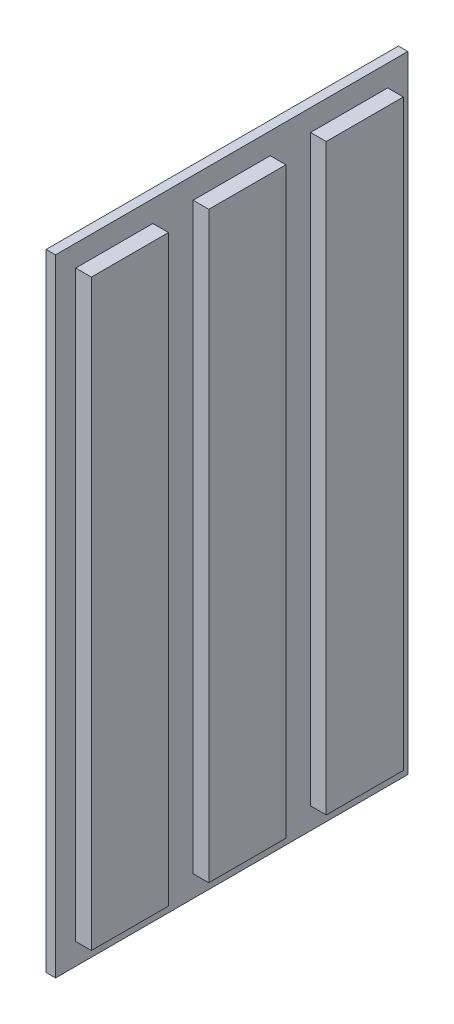
from build123d import *

# Parameters (mm, degrees)
SKETCH1_W           = 80
SKETCH1_H           = 45
BOSS_EXTRUDE1_DEPTH = 1.2
SKETCH2_W           = 74.5
SKETCH2_H           = 9.85
BOSS_EXTRUDE2_DEPTH = 2
LPATTERN1_COUNT     = 3
LPATTERN1_PITCH     = 15
SKETCH3_W           = 2.467948718
SKETCH3_H           = 0.224358974
CUT_EXTRUDE1_DEPTH  = 0.6


with BuildPart() as part:
    # Sketch1 → Boss-Extrude1 (new body)
    with BuildSketch(Plane.YZ):
        Rectangle(SKETCH1_W, SKETCH1_H)
    extrude(amount=-BOSS_EXTRUDE1_DEPTH)

    # Sketch2 → Boss-Extrude2 (add)
    with BuildSketch(Plane.YZ):
        with Locations((0, 15)):
            Rectangle(SKETCH2_W, SKETCH2_H)
    boss_extrude2 = extrude(amount=BOSS_EXTRUDE2_DEPTH)

    # LPattern1: Boss-Extrude2 ×3
    with Locations(*[(0, 0, -i * LPATTERN1_PITCH) for i in range(1, LPATTERN1_COUNT)]):
        add(boss_extrude2)

    # Sketch3 → Cut-Extrude1 (cut)
    # profile 1 of 10: a face of its own
    with BuildSketch(Plane(origin=(-1.2, 0, 0), x_dir=(0, -1, 0), z_dir=(-1, 0, 0))):
        with BuildLine():
            Line((-12.550080128, 4.83525641), (-13.106770833, 5.115705128))
            Line((-13.106770833, 5.115705128), (-12.496794872, 6.316025641))
            add(Edge.make_bspline(
                [(-12.496794872, 6.316025641), (-12.532833652, 6.316944222), (-12.603586497, 6.318747618), (-12.707764541, 6.333733822), (-12.807387496, 6.359316228), (-12.903629589, 6.393372857), (-12.995159823, 6.439029296), (-13.083088073, 6.49351786), (-13.166197117, 6.558985086), (-13.244876618, 6.632572956), (-13.316713516, 6.713911371), (-13.379066424, 6.80138946), (-13.433414156, 6.89278816), (-13.475677933, 6.990170863), (-13.509624414, 7.091722597), (-13.534427424, 7.197969005), (-13.548346218, 7.309376228), (-13.550291671, 7.385198766), (-13.551282051, 7.423798077)],
                knots=[0, 0, 0, 0, 1.014336294, 1.991387562, 2.955278539, 3.906441712, 4.859855302, 5.829322156, 6.813833455, 7.833278715, 8.858926674, 9.863225732, 10.85404919, 11.846815163, 12.845559416, 13.865450493, 14.913355531, 16, 16, 16, 16], degree=3))
            add(Edge.make_bspline(
                [(-13.551282051, 7.423798077), (-13.550363419, 7.461239029), (-13.548553274, 7.535015649), (-13.533519845, 7.643295719), (-13.508778711, 7.747260406), (-13.474834762, 7.846892046), (-13.429646728, 7.941518808), (-13.376755284, 8.032622327), (-13.312097893, 8.118317768), (-13.239057038, 8.198976108), (-13.159117699, 8.272764248), (-13.07430877, 8.337642055), (-12.985015866, 8.391873668), (-12.892386488, 8.437418218), (-12.794746294, 8.471446272), (-12.693506293, 8.497120187), (-12.587912315, 8.511937705), (-12.516237325, 8.513800811), (-12.479967949, 8.51474359)],
                knots=[0, 0, 0, 0, 1.055538678, 2.079917126, 3.075849687, 4.065898488, 5.041806164, 6.028602842, 7.031727914, 8.062953097, 9.093756959, 10.095582084, 11.068815425, 12.035667573, 13.000833448, 13.979119574, 14.977382875, 16, 16, 16, 16], degree=3))
            add(Edge.make_bspline(
                [(-12.479967949, 8.51474359), (-12.442043928, 8.513962965), (-12.367471474, 8.512427971), (-12.258307415, 8.495489925), (-12.153863662, 8.469503864), (-12.053715843, 8.434209492), (-11.95910725, 8.386307724), (-11.869246249, 8.328897121), (-11.784431745, 8.260707436), (-11.705574584, 8.183704107), (-11.633854877, 8.099948579), (-11.570284281, 8.012276747), (-11.516882281, 7.920860034), (-11.473142777, 7.826514303), (-11.439069923, 7.729091749), (-11.415649179, 7.628454183), (-11.400100402, 7.5247737), (-11.398331261, 7.45447067), (-11.397435897, 7.418890224)],
                knots=[0, 0, 0, 0, 1.062826075, 2.08990367, 3.089830715, 4.078784409, 5.060762809, 6.057138927, 7.064407536, 8.107320944, 9.143871033, 10.153461498, 11.140480137, 12.108246174, 13.065926856, 14.029354859, 15.002654194, 16, 16, 16, 16], degree=3))
            add(Edge.make_bspline(
                [(-11.397435897, 7.418890224), (-11.397924506, 7.391753863), (-11.398908673, 7.337095131), (-11.408585754, 7.255128437), (-11.423267836, 7.172934565), (-11.4403095, 7.103829904), (-11.458175314, 7.045578872), (-11.475560786, 6.996163674), (-11.497866858, 6.941303526), (-11.522773816, 6.880630714), (-11.551619006, 6.814411294), (-11.585000479, 6.742961821), (-11.620900749, 6.665222629), (-11.647362792, 6.612065628), (-11.661057692, 6.584555288)],
                knots=[0, 0, 0, 0, 1.105131805, 2.225983929, 3.357782449, 4.505488967, 5.122909461, 5.839607681, 6.638776516, 7.535249922, 8.51168636, 9.581005249, 10.748097757, 12, 12, 12, 12], degree=3))
            Line((-11.661057692, 6.584555288), (-12.550080128, 4.83525641))
        make_face()
        with BuildLine():
            add(Edge.make_bspline(
                [(-12.465945513, 6.899358974), (-12.43584454, 6.901131106), (-12.377034056, 6.904593449), (-12.292556705, 6.931365028), (-12.216953772, 6.977178471), (-12.149944148, 7.038042239), (-12.094569445, 7.11229882), (-12.054308413, 7.196833337), (-12.029508856, 7.289895173), (-12.026955068, 7.354697212), (-12.025641026, 7.388040865)],
                knots=[0, 0, 0, 0, 0.984774978, 1.924027336, 2.867853169, 3.859505234, 4.871392407, 5.881338128, 6.909850265, 8, 8, 8, 8], degree=3))
            add(Edge.make_bspline(
                [(-12.025641026, 7.388040865), (-12.027223646, 7.422078143), (-12.030302222, 7.488288776), (-12.055339348, 7.583584452), (-12.098122761, 7.669726092), (-12.156327147, 7.744606899), (-12.224280008, 7.807272569), (-12.30026846, 7.853048153), (-12.382447344, 7.881354307), (-12.439318006, 7.884798478), (-12.468048878, 7.886538462)],
                knots=[0, 0, 0, 0, 1.104110315, 2.147758178, 3.172670271, 4.206310416, 5.210906102, 6.157051016, 7.068948237, 8, 8, 8, 8], degree=3))
            add(Edge.make_bspline(
                [(-12.468048878, 7.886538462), (-12.498415797, 7.884842202), (-12.558040994, 7.88151161), (-12.643567588, 7.853273431), (-12.722409682, 7.808376891), (-12.791260691, 7.7454986), (-12.850848599, 7.671603948), (-12.892400874, 7.585171542), (-12.918688284, 7.490540876), (-12.92158774, 7.424211507), (-12.923076923, 7.390144231)],
                knots=[0, 0, 0, 0, 0.970967322, 1.90648639, 2.855811969, 3.858352357, 4.877096915, 5.878517833, 6.91039038, 8, 8, 8, 8], degree=3))
            add(Edge.make_bspline(
                [(-12.923076923, 7.390144231), (-12.921521379, 7.356562559), (-12.918496009, 7.291249713), (-12.89314033, 7.197660087), (-12.85183847, 7.112678206), (-12.79537588, 7.037836006), (-12.725827875, 6.976672356), (-12.646861468, 6.931346919), (-12.558776269, 6.904520858), (-12.497446118, 6.901110576), (-12.465945513, 6.899358974)],
                knots=[0, 0, 0, 0, 1.075706617, 2.092137047, 3.084482865, 4.090466434, 5.0784141, 6.035155512, 6.990809768, 8, 8, 8, 8], degree=3))
        make_face(mode=Mode.SUBTRACT)
    # profile 2 of 10: a face of its own
    with BuildSketch(Plane(origin=(-1.2, 0, 0), x_dir=(0, -1, 0), z_dir=(-1, 0, 0))):
        with BuildLine():
            Line((-10.320512821, 7.258333333), (-10.948717949, 7.258333333))
            add(Edge.make_bspline(
                [(-10.948717949, 7.258333333), (-10.946004827, 7.305853728), (-10.94070355, 7.398705726), (-10.919616412, 7.533576225), (-10.891360369, 7.661014017), (-10.853648929, 7.780573308), (-10.806262038, 7.892210656), (-10.750419082, 7.996306638), (-10.684693399, 8.092313186), (-10.61048385, 8.179767303), (-10.529050308, 8.258223199), (-10.442083414, 8.327787125), (-10.34825289, 8.385189525), (-10.249273099, 8.432426387), (-10.145160894, 8.470166444), (-10.03493121, 8.495398727), (-9.919538475, 8.512486275), (-9.840542804, 8.513981504), (-9.800280449, 8.51474359)],
                knots=[0, 0, 0, 0, 1.199038563, 2.342849363, 3.436047546, 4.486744587, 5.497670872, 6.488682221, 7.459191391, 8.424610317, 9.374430501, 10.305433194, 11.225809216, 12.140057399, 13.06607119, 14.010487599, 14.985989317, 16, 16, 16, 16], degree=3))
            add(Edge.make_bspline(
                [(-9.800280449, 8.51474359), (-9.750858979, 8.51320151), (-9.654376689, 8.510191008), (-9.514180268, 8.484510428), (-9.38325214, 8.441555691), (-9.261687476, 8.381536594), (-9.150521179, 8.305288623), (-9.049771682, 8.214375396), (-8.962485811, 8.106889507), (-8.888110148, 7.987303267), (-8.826312862, 7.86067827), (-8.783007897, 7.729742772), (-8.75454401, 7.59797127), (-8.75150816, 7.509243011), (-8.75, 7.465164263)],
                knots=[0, 0, 0, 0, 1.075374347, 2.099382735, 3.09057751, 4.06680945, 5.040638231, 6.016817125, 7.011024321, 8.044445721, 9.0776792, 10.070479129, 11.0414456, 12, 12, 12, 12], degree=3))
            add(Edge.make_bspline(
                [(-8.75, 7.465164263), (-8.750587198, 7.438502321), (-8.751769083, 7.384838418), (-8.759986883, 7.303631761), (-8.772315208, 7.220913287), (-8.790903318, 7.136753919), (-8.814084215, 7.051130065), (-8.842205993, 6.963785484), (-8.875920965, 6.875215386), (-8.914666496, 6.784422931), (-8.960890013, 6.691113351), (-9.014710874, 6.593887899), (-9.077557606, 6.492832821), (-9.148671099, 6.387377529), (-9.228396736, 6.27768834), (-9.31712371, 6.164095673), (-9.413830094, 6.046199265), (-9.482465336, 5.967392132), (-9.517728365, 5.926903045)],
                knots=[0, 0, 0, 0, 0.728284026, 1.46585585, 2.227944881, 3.01186502, 3.81876927, 4.650621989, 5.517437689, 6.406905708, 7.346299482, 8.360816762, 9.441613733, 10.596154504, 11.834900912, 13.145207542, 14.533280747, 16, 16, 16, 16], degree=3))
            Line((-9.517728365, 5.926903045), (-9.883012821, 5.508333333))
            Line((-9.883012821, 5.508333333), (-8.705128205, 5.508333333))
            Line((-8.705128205, 5.508333333), (-8.705128205, 4.925))
            Line((-8.705128205, 4.925), (-11.038461538, 4.925))
            Line((-11.038461538, 4.925), (-11.038461538, 5.243309295))
            Line((-11.038461538, 5.243309295), (-10.002203526, 6.346173878))
            add(Edge.make_bspline(
                [(-10.002203526, 6.346173878), (-9.972201193, 6.378344781), (-9.914095573, 6.440650278), (-9.831417263, 6.53215253), (-9.756600696, 6.618985982), (-9.691197254, 6.702075237), (-9.631774648, 6.778725216), (-9.580982529, 6.851246247), (-9.538356188, 6.918982712), (-9.492079249, 7.000661059), (-9.448131369, 7.098077022), (-9.40780653, 7.210304206), (-9.383225749, 7.317567547), (-9.379832824, 7.387462646), (-9.378205128, 7.42099359)],
                knots=[0, 0, 0, 0, 1.246127091, 2.413378631, 3.493388633, 4.492180848, 5.408488754, 6.240484944, 6.999099869, 7.674939598, 8.898438119, 10.020720584, 11.050475521, 12, 12, 12, 12], degree=3))
            add(Edge.make_bspline(
                [(-9.378205128, 7.42099359), (-9.379422117, 7.453432191), (-9.381780229, 7.516287182), (-9.407693962, 7.605698073), (-9.447840416, 7.686650506), (-9.50441244, 7.756725534), (-9.57293888, 7.814310831), (-9.652127617, 7.857141156), (-9.741333032, 7.881854058), (-9.803867728, 7.884947231), (-9.83603766, 7.886538462)],
                knots=[0, 0, 0, 0, 1.062038974, 2.057870785, 3.028805853, 4.01125022, 4.991535629, 5.949134679, 6.94496649, 8, 8, 8, 8], degree=3))
            add(Edge.make_bspline(
                [(-9.83603766, 7.886538462), (-9.852657057, 7.885950642), (-9.885375009, 7.884793424), (-9.933467841, 7.877090139), (-9.979231626, 7.863513903), (-10.02317574, 7.845323658), (-10.0648312, 7.821212358), (-10.104092938, 7.791491338), (-10.141374626, 7.756915879), (-10.176505275, 7.717594092), (-10.208478751, 7.673710967), (-10.236877476, 7.625667285), (-10.260358494, 7.57349287), (-10.281032036, 7.517876502), (-10.296976461, 7.458220817), (-10.30858598, 7.394882848), (-10.317411922, 7.327965636), (-10.319460384, 7.281966346), (-10.320512821, 7.258333333)],
                knots=[0, 0, 0, 0, 0.903469896, 1.778625579, 2.63899355, 3.493148037, 4.358286772, 5.247621495, 6.164656832, 7.118446693, 8.109501108, 9.111810964, 10.146451449, 11.215617525, 12.33435995, 13.498009769, 14.714554818, 16, 16, 16, 16], degree=3))
        make_face()
    # profile 3 of 10: a face of its own
    with BuildSketch(Plane(origin=(-1.2, 0, 0), x_dir=(0, -1, 0), z_dir=(-1, 0, 0))):
        with BuildLine():
            Line((-7.628205128, 7.258333333), (-8.256410256, 7.258333333))
            add(Edge.make_bspline(
                [(-8.256410256, 7.258333333), (-8.253697135, 7.305853728), (-8.248395858, 7.398705726), (-8.227308719, 7.533576225), (-8.199052677, 7.661014017), (-8.161341237, 7.780573308), (-8.113954346, 7.892210656), (-8.058111389, 7.996306638), (-7.992385707, 8.092313186), (-7.918176158, 8.179767303), (-7.836742616, 8.258223199), (-7.749775721, 8.327787125), (-7.655945198, 8.385189525), (-7.556965407, 8.432426387), (-7.452853201, 8.470166444), (-7.342623517, 8.495398727), (-7.227230783, 8.512486275), (-7.148235111, 8.513981504), (-7.107972756, 8.51474359)],
                knots=[0, 0, 0, 0, 1.199038563, 2.342849363, 3.436047546, 4.486744587, 5.497670872, 6.488682221, 7.459191391, 8.424610317, 9.374430501, 10.305433194, 11.225809216, 12.140057399, 13.06607119, 14.010487599, 14.985989317, 16, 16, 16, 16], degree=3))
            add(Edge.make_bspline(
                [(-7.107972756, 8.51474359), (-7.058551287, 8.51320151), (-6.962068997, 8.510191008), (-6.821872576, 8.484510428), (-6.690944447, 8.441555691), (-6.569379784, 8.381536594), (-6.458213487, 8.305288623), (-6.35746399, 8.214375396), (-6.270178119, 8.106889507), (-6.195802456, 7.987303267), (-6.134005169, 7.86067827), (-6.090700205, 7.729742772), (-6.062236318, 7.59797127), (-6.059200468, 7.509243011), (-6.057692308, 7.465164263)],
                knots=[0, 0, 0, 0, 1.075374347, 2.099382735, 3.09057751, 4.06680945, 5.040638231, 6.016817125, 7.011024321, 8.044445721, 9.0776792, 10.070479129, 11.0414456, 12, 12, 12, 12], degree=3))
            add(Edge.make_bspline(
                [(-6.057692308, 7.465164263), (-6.058279506, 7.438502321), (-6.05946139, 7.384838418), (-6.067679191, 7.303631761), (-6.080007516, 7.220913287), (-6.098595626, 7.136753919), (-6.121776522, 7.051130065), (-6.1498983, 6.963785484), (-6.183613272, 6.875215386), (-6.222358804, 6.784422931), (-6.268582321, 6.691113351), (-6.322403182, 6.593887899), (-6.385249913, 6.492832821), (-6.456363407, 6.387377529), (-6.536089043, 6.27768834), (-6.624816017, 6.164095673), (-6.721522402, 6.046199265), (-6.790157644, 5.967392132), (-6.825420673, 5.926903045)],
                knots=[0, 0, 0, 0, 0.728284026, 1.46585585, 2.227944881, 3.01186502, 3.81876927, 4.650621989, 5.517437689, 6.406905708, 7.346299482, 8.360816762, 9.441613733, 10.596154504, 11.834900912, 13.145207542, 14.533280747, 16, 16, 16, 16], degree=3))
            Line((-6.825420673, 5.926903045), (-7.190705128, 5.508333333))
            Line((-7.190705128, 5.508333333), (-6.012820513, 5.508333333))
            Line((-6.012820513, 5.508333333), (-6.012820513, 4.925))
            Line((-6.012820513, 4.925), (-8.346153846, 4.925))
            Line((-8.346153846, 4.925), (-8.346153846, 5.243309295))
            Line((-8.346153846, 5.243309295), (-7.309895833, 6.346173878))
            add(Edge.make_bspline(
                [(-7.309895833, 6.346173878), (-7.279893501, 6.378344781), (-7.22178788, 6.440650278), (-7.13910957, 6.53215253), (-7.064293003, 6.618985982), (-6.998889561, 6.702075237), (-6.939466956, 6.778725216), (-6.888674837, 6.851246247), (-6.846048496, 6.918982712), (-6.799771557, 7.000661059), (-6.755823677, 7.098077022), (-6.715498837, 7.210304206), (-6.690918057, 7.317567547), (-6.687525132, 7.387462646), (-6.685897436, 7.42099359)],
                knots=[0, 0, 0, 0, 1.246127091, 2.413378631, 3.493388633, 4.492180848, 5.408488754, 6.240484944, 6.999099869, 7.674939598, 8.898438119, 10.020720584, 11.050475521, 12, 12, 12, 12], degree=3))
            add(Edge.make_bspline(
                [(-6.685897436, 7.42099359), (-6.687114425, 7.453432191), (-6.689472536, 7.516287182), (-6.71538627, 7.605698073), (-6.755532724, 7.686650506), (-6.812104748, 7.756725534), (-6.880631188, 7.814310831), (-6.959819925, 7.857141156), (-7.04902534, 7.881854058), (-7.111560035, 7.884947231), (-7.143729968, 7.886538462)],
                knots=[0, 0, 0, 0, 1.062038974, 2.057870785, 3.028805853, 4.01125022, 4.991535629, 5.949134679, 6.94496649, 8, 8, 8, 8], degree=3))
            add(Edge.make_bspline(
                [(-7.143729968, 7.886538462), (-7.160349365, 7.885950642), (-7.193067317, 7.884793424), (-7.241160149, 7.877090139), (-7.286923934, 7.863513903), (-7.330868048, 7.845323658), (-7.372523508, 7.821212358), (-7.411785246, 7.791491338), (-7.449066934, 7.756915879), (-7.484197582, 7.717594092), (-7.516171059, 7.673710967), (-7.544569784, 7.625667285), (-7.568050802, 7.57349287), (-7.588724344, 7.517876502), (-7.604668768, 7.458220817), (-7.616278287, 7.394882848), (-7.625104229, 7.327965636), (-7.627152692, 7.281966346), (-7.628205128, 7.258333333)],
                knots=[0, 0, 0, 0, 0.903469896, 1.778625579, 2.63899355, 3.493148037, 4.358286772, 5.247621495, 6.164656832, 7.118446693, 8.109501108, 9.111810964, 10.146451449, 11.215617525, 12.33435995, 13.498009769, 14.714554818, 16, 16, 16, 16], degree=3))
        make_face()
    # profile 4 of 10: a face of its own
    with BuildSketch(Plane(origin=(-1.2, 0, 0), x_dir=(0, -1, 0), z_dir=(-1, 0, 0))):
        with BuildLine():
            Line((-4.935897436, 7.258333333), (-5.564102564, 7.258333333))
            add(Edge.make_bspline(
                [(-5.564102564, 7.258333333), (-5.561389442, 7.305853728), (-5.556088166, 7.398705726), (-5.535001027, 7.533576225), (-5.506744984, 7.661014017), (-5.469033545, 7.780573308), (-5.421646653, 7.892210656), (-5.365803697, 7.996306638), (-5.300078015, 8.092313186), (-5.225868466, 8.179767303), (-5.144434924, 8.258223199), (-5.057468029, 8.327787125), (-4.963637506, 8.385189525), (-4.864657714, 8.432426387), (-4.760545509, 8.470166444), (-4.650315825, 8.495398727), (-4.53492309, 8.512486275), (-4.455927419, 8.513981504), (-4.415665064, 8.51474359)],
                knots=[0, 0, 0, 0, 1.199038563, 2.342849363, 3.436047546, 4.486744587, 5.497670872, 6.488682221, 7.459191391, 8.424610317, 9.374430501, 10.305433194, 11.225809216, 12.140057399, 13.06607119, 14.010487599, 14.985989317, 16, 16, 16, 16], degree=3))
            add(Edge.make_bspline(
                [(-4.415665064, 8.51474359), (-4.366243595, 8.51320151), (-4.269761304, 8.510191008), (-4.129564884, 8.484510428), (-3.998636755, 8.441555691), (-3.877072092, 8.381536594), (-3.765905794, 8.305288623), (-3.665156297, 8.214375396), (-3.577870427, 8.106889507), (-3.503494764, 7.987303267), (-3.441697477, 7.86067827), (-3.398392513, 7.729742772), (-3.369928626, 7.59797127), (-3.366892776, 7.509243011), (-3.365384615, 7.465164263)],
                knots=[0, 0, 0, 0, 1.075374347, 2.099382735, 3.09057751, 4.06680945, 5.040638231, 6.016817125, 7.011024321, 8.044445721, 9.0776792, 10.070479129, 11.0414456, 12, 12, 12, 12], degree=3))
            add(Edge.make_bspline(
                [(-3.365384615, 7.465164263), (-3.365971813, 7.438502321), (-3.367153698, 7.384838418), (-3.375371499, 7.303631761), (-3.387699824, 7.220913287), (-3.406287933, 7.136753919), (-3.42946883, 7.051130065), (-3.457590608, 6.963785484), (-3.49130558, 6.875215386), (-3.530051112, 6.784422931), (-3.576274629, 6.691113351), (-3.630095489, 6.593887899), (-3.692942221, 6.492832821), (-3.764055715, 6.387377529), (-3.843781351, 6.27768834), (-3.932508325, 6.164095673), (-4.02921471, 6.046199265), (-4.097849951, 5.967392132), (-4.133112981, 5.926903045)],
                knots=[0, 0, 0, 0, 0.728284026, 1.46585585, 2.227944881, 3.01186502, 3.81876927, 4.650621989, 5.517437689, 6.406905708, 7.346299482, 8.360816762, 9.441613733, 10.596154504, 11.834900912, 13.145207542, 14.533280747, 16, 16, 16, 16], degree=3))
            Line((-4.133112981, 5.926903045), (-4.498397436, 5.508333333))
            Line((-4.498397436, 5.508333333), (-3.320512821, 5.508333333))
            Line((-3.320512821, 5.508333333), (-3.320512821, 4.925))
            Line((-3.320512821, 4.925), (-5.653846154, 4.925))
            Line((-5.653846154, 4.925), (-5.653846154, 5.243309295))
            Line((-5.653846154, 5.243309295), (-4.617588141, 6.346173878))
            add(Edge.make_bspline(
                [(-4.617588141, 6.346173878), (-4.587585809, 6.378344781), (-4.529480188, 6.440650278), (-4.446801878, 6.53215253), (-4.371985311, 6.618985982), (-4.306581869, 6.702075237), (-4.247159264, 6.778725216), (-4.196367145, 6.851246247), (-4.153740804, 6.918982712), (-4.107463864, 7.000661059), (-4.063515985, 7.098077022), (-4.023191145, 7.210304206), (-3.998610365, 7.317567547), (-3.99521744, 7.387462646), (-3.993589744, 7.42099359)],
                knots=[0, 0, 0, 0, 1.246127091, 2.413378631, 3.493388633, 4.492180848, 5.408488754, 6.240484944, 6.999099869, 7.674939598, 8.898438119, 10.020720584, 11.050475521, 12, 12, 12, 12], degree=3))
            add(Edge.make_bspline(
                [(-3.993589744, 7.42099359), (-3.994806733, 7.453432191), (-3.997164844, 7.516287182), (-4.023078577, 7.605698073), (-4.063225032, 7.686650506), (-4.119797056, 7.756725534), (-4.188323495, 7.814310831), (-4.267512233, 7.857141156), (-4.356717648, 7.881854058), (-4.419252343, 7.884947231), (-4.451422276, 7.886538462)],
                knots=[0, 0, 0, 0, 1.062038974, 2.057870785, 3.028805853, 4.01125022, 4.991535629, 5.949134679, 6.94496649, 8, 8, 8, 8], degree=3))
            add(Edge.make_bspline(
                [(-4.451422276, 7.886538462), (-4.468041673, 7.885950642), (-4.500759624, 7.884793424), (-4.548852456, 7.877090139), (-4.594616241, 7.863513903), (-4.638560355, 7.845323658), (-4.680215815, 7.821212358), (-4.719477553, 7.791491338), (-4.756759241, 7.756915879), (-4.79188989, 7.717594092), (-4.823863367, 7.673710967), (-4.852262092, 7.625667285), (-4.87574311, 7.57349287), (-4.896416651, 7.517876502), (-4.912361076, 7.458220817), (-4.923970595, 7.394882848), (-4.932796537, 7.327965636), (-4.934844999, 7.281966346), (-4.935897436, 7.258333333)],
                knots=[0, 0, 0, 0, 0.903469896, 1.778625579, 2.63899355, 3.493148037, 4.358286772, 5.247621495, 6.164656832, 7.118446693, 8.109501108, 9.111810964, 10.146451449, 11.215617525, 12.33435995, 13.498009769, 14.714554818, 16, 16, 16, 16], degree=3))
        make_face()
    # profile 5 of 10: a face of its own
    with BuildSketch(Plane(origin=(-1.2, 0, 0), x_dir=(0, -1, 0), z_dir=(-1, 0, 0))):
        with BuildLine():
            Line((-2.108974359, 7.572435897), (-2.737179487, 7.572435897))
            add(Edge.make_bspline(
                [(-2.737179487, 7.572435897), (-2.73274412, 7.603837631), (-2.724048877, 7.665398649), (-2.703242322, 7.754523667), (-2.678355437, 7.839064846), (-2.647285433, 7.918754462), (-2.610845373, 7.993734468), (-2.569405812, 8.064262159), (-2.522518772, 8.130034816), (-2.48657936, 8.169656526), (-2.46864984, 8.189423077)],
                knots=[0, 0, 0, 0, 1.111473889, 2.178970933, 3.205615836, 4.199322666, 5.174200091, 6.12565194, 7.064921805, 8, 8, 8, 8], degree=3))
            add(Edge.make_bspline(
                [(-2.46864984, 8.189423077), (-2.442788883, 8.215503609), (-2.391819655, 8.266905597), (-2.306644097, 8.332745865), (-2.217364382, 8.38972614), (-2.122189966, 8.434900514), (-2.022601836, 8.471463936), (-1.917808031, 8.496023669), (-1.808236778, 8.512319269), (-1.733468182, 8.513924443), (-1.6953125, 8.51474359)],
                knots=[0, 0, 0, 0, 1.01925491, 2.00884431, 2.983262333, 3.955970413, 4.92937149, 5.924503185, 6.940838805, 8, 8, 8, 8], degree=3))
            add(Edge.make_bspline(
                [(-1.6953125, 8.51474359), (-1.661390136, 8.513942749), (-1.594705603, 8.512368458), (-1.49669612, 8.499730903), (-1.403252279, 8.477566039), (-1.313386353, 8.448585976), (-1.228419976, 8.409153758), (-1.146477858, 8.363381345), (-1.069849465, 8.307239579), (-0.998355501, 8.243805033), (-0.932674659, 8.175194362), (-0.875794762, 8.101855197), (-0.826894094, 8.025746596), (-0.786606412, 7.946236241), (-0.755630659, 7.86318959), (-0.734132568, 7.777086394), (-0.720061545, 7.688116644), (-0.718659704, 7.627645104), (-0.717948718, 7.59697516)],
                knots=[0, 0, 0, 0, 1.091422571, 2.145516843, 3.172569842, 4.178562979, 5.178154469, 6.181868002, 7.194278174, 8.227918432, 9.254613415, 10.245994977, 11.209837596, 12.161663635, 13.10878368, 14.055455738, 15.013766427, 16, 16, 16, 16], degree=3))
            add(Edge.make_bspline(
                [(-0.717948718, 7.59697516), (-0.719407703, 7.558992989), (-0.722279996, 7.484217771), (-0.745849242, 7.374778683), (-0.78274152, 7.270135386), (-0.836036004, 7.171751995), (-0.902667683, 7.079896255), (-0.984422521, 6.997639179), (-1.078971929, 6.923691089), (-1.149951429, 6.883951376), (-1.186298077, 6.863601763)],
                knots=[0, 0, 0, 0, 0.992805628, 1.954529043, 2.915727527, 3.886831945, 4.871318353, 5.87440735, 6.911542536, 8, 8, 8, 8], degree=3))
            add(Edge.make_bspline(
                [(-1.186298077, 6.863601763), (-1.161350296, 6.855410881), (-1.112329025, 6.839316166), (-1.042651182, 6.807617805), (-0.976395515, 6.772976752), (-0.914702924, 6.73273298), (-0.8569598, 6.688513768), (-0.803518153, 6.639941116), (-0.75405868, 6.587120934), (-0.709388789, 6.52976273), (-0.669742515, 6.468783839), (-0.634170024, 6.405592836), (-0.604891881, 6.339231418), (-0.58008965, 6.270457477), (-0.561206642, 6.19865291), (-0.547911318, 6.124095953), (-0.540226294, 6.046956675), (-0.539054197, 5.994694861), (-0.538461538, 5.968269231)],
                knots=[0, 0, 0, 0, 1.059543567, 2.081955587, 3.086750234, 4.076226789, 5.052108497, 6.020845489, 6.989030705, 7.970690546, 8.952259656, 9.923888338, 10.895517021, 11.877585046, 12.873342345, 13.889638361, 14.932918083, 16, 16, 16, 16], degree=3))
            add(Edge.make_bspline(
                [(-0.538461538, 5.968269231), (-0.539662937, 5.929434283), (-0.54203185, 5.852859676), (-0.55709229, 5.740073116), (-0.585132115, 5.632541152), (-0.622020058, 5.529026466), (-0.671224571, 5.430865394), (-0.72913001, 5.335805276), (-0.800307429, 5.247142768), (-0.87940891, 5.162533864), (-0.967255715, 5.085611238), (-1.062495943, 5.018922782), (-1.163035343, 4.961692221), (-1.269509999, 4.915230822), (-1.38188292, 4.87945023), (-1.499903636, 4.853586369), (-1.624068037, 4.837762431), (-1.708819956, 4.836103592), (-1.752103365, 4.83525641)],
                knots=[0, 0, 0, 0, 1.005138573, 1.981928558, 2.936866704, 3.876260664, 4.820238198, 5.773547, 6.751179199, 7.756627054, 8.768222608, 9.766606018, 10.760583154, 11.757261445, 12.767156078, 13.807575856, 14.880313354, 16, 16, 16, 16], degree=3))
            add(Edge.make_bspline(
                [(-1.752103365, 4.83525641), (-1.793048773, 4.83614962), (-1.873112098, 4.837896173), (-1.990221468, 4.853013474), (-2.101522839, 4.877398908), (-2.207300253, 4.911772198), (-2.307144468, 4.956348482), (-2.401960908, 5.009428835), (-2.489857533, 5.074074806), (-2.571813684, 5.147368157), (-2.646011326, 5.229599134), (-2.712326545, 5.318862899), (-2.769297079, 5.415498884), (-2.817156564, 5.519094222), (-2.855530848, 5.629830648), (-2.88580037, 5.747482976), (-2.906944127, 5.87228106), (-2.913383502, 5.958144797), (-2.916666667, 6.001923077)],
                knots=[0, 0, 0, 0, 1.066544725, 2.085487077, 3.070979577, 4.031932826, 4.977951092, 5.916076795, 6.857635327, 7.814973522, 8.776389752, 9.738577119, 10.707772778, 11.69409279, 12.707140348, 13.757286496, 14.856535458, 16, 16, 16, 16], degree=3))
            Line((-2.916666667, 6.001923077), (-2.288461538, 6.001923077))
            add(Edge.make_bspline(
                [(-2.288461538, 6.001923077), (-2.284480668, 5.979910783), (-2.276726879, 5.937036069), (-2.261603589, 5.874963013), (-2.241895832, 5.817665749), (-2.219108762, 5.76463502), (-2.194495296, 5.715174551), (-2.164756342, 5.671111038), (-2.132071016, 5.631247979), (-2.084905853, 5.583858334), (-2.017480003, 5.535167452), (-1.926432768, 5.492852759), (-1.82515134, 5.468051151), (-1.754345522, 5.46502543), (-1.717748397, 5.463461538)],
                knots=[0, 0, 0, 0, 0.928156231, 1.807827665, 2.648129825, 3.438902246, 4.202261636, 4.936546065, 5.639352463, 6.338805438, 7.70633318, 9.064371875, 10.482673459, 12, 12, 12, 12], degree=3))
            add(Edge.make_bspline(
                [(-1.717748397, 5.463461538), (-1.69832867, 5.463794555), (-1.660289767, 5.464446859), (-1.604416284, 5.471676775), (-1.551188924, 5.483584452), (-1.500508549, 5.499766545), (-1.452052524, 5.52005181), (-1.40674665, 5.546208445), (-1.363667481, 5.576619267), (-1.323283325, 5.610809104), (-1.285967533, 5.648063787), (-1.2549186, 5.68931702), (-1.226542121, 5.731237678), (-1.205554673, 5.776568358), (-1.187165147, 5.822869785), (-1.175909818, 5.871822556), (-1.167411236, 5.922399774), (-1.166917333, 5.957012602), (-1.166666667, 5.974579327)],
                knots=[0, 0, 0, 0, 1.110435564, 2.175094844, 3.216326037, 4.226890168, 5.215276772, 6.21526065, 7.213097102, 8.228249917, 9.239874822, 10.221364777, 11.178138315, 12.128914389, 13.072518965, 14.022636769, 14.996447288, 16, 16, 16, 16], degree=3))
            add(Edge.make_bspline(
                [(-1.166666667, 5.974579327), (-1.167332139, 5.993791534), (-1.168656941, 6.032038636), (-1.179480712, 6.08785224), (-1.196573735, 6.141540428), (-1.220318032, 6.192865444), (-1.252025894, 6.241638115), (-1.289440817, 6.288836968), (-1.33551048, 6.332005386), (-1.386055069, 6.374676059), (-1.444666936, 6.411872017), (-1.508491601, 6.446198421), (-1.579206474, 6.473511641), (-1.655085344, 6.497907405), (-1.737563528, 6.515725692), (-1.82612887, 6.528663506), (-1.920638498, 6.538293703), (-1.985785214, 6.539675313), (-2.019230769, 6.540384615)],
                knots=[0, 0, 0, 0, 0.809814727, 1.612155564, 2.388397, 3.182215007, 3.988903953, 4.837162975, 5.715530372, 6.646997145, 7.623086902, 8.637258368, 9.698941581, 10.815059213, 11.996518529, 13.252603015, 14.589518788, 16, 16, 16, 16], degree=3))
            Line((-2.019230769, 6.540384615), (-2.019230769, 7.123717949))
            add(Edge.make_bspline(
                [(-2.019230769, 7.123717949), (-1.977589064, 7.12726429), (-1.899685679, 7.133898791), (-1.791551604, 7.149413803), (-1.700516652, 7.170152172), (-1.624392797, 7.195171891), (-1.561184425, 7.227303729), (-1.50596594, 7.262775858), (-1.458409168, 7.303971553), (-1.418217317, 7.349662363), (-1.386065087, 7.398730008), (-1.363309611, 7.450411832), (-1.348283084, 7.503108735), (-1.346859322, 7.539151828), (-1.346153846, 7.557011218)],
                knots=[0, 0, 0, 0, 1.70044513, 3.18119609, 4.440695891, 5.496282586, 6.431922213, 7.318171381, 8.16090191, 8.983045123, 9.787564368, 10.536848927, 11.275007137, 12, 12, 12, 12], degree=3))
            add(Edge.make_bspline(
                [(-1.346153846, 7.557011218), (-1.347370994, 7.57979786), (-1.349746608, 7.624272562), (-1.368196915, 7.687925229), (-1.400224558, 7.744666306), (-1.443168003, 7.794376394), (-1.495496084, 7.835897985), (-1.556833768, 7.866041952), (-1.625850025, 7.883752878), (-1.674406679, 7.885588905), (-1.699519231, 7.886538462)],
                knots=[0, 0, 0, 0, 1.009664648, 1.970651636, 2.907870547, 3.878035693, 4.867062054, 5.849714035, 6.887914197, 8, 8, 8, 8], degree=3))
            add(Edge.make_bspline(
                [(-1.699519231, 7.886538462), (-1.722280935, 7.885418084), (-1.767447128, 7.883194913), (-1.83349362, 7.866601749), (-1.896215784, 7.838669222), (-1.95431482, 7.800151914), (-2.006952056, 7.75389426), (-2.05015204, 7.69911167), (-2.086083739, 7.639086265), (-2.10131424, 7.594739782), (-2.108974359, 7.572435897)],
                knots=[0, 0, 0, 0, 0.98818071, 1.960853194, 2.938124878, 3.957524365, 4.978590984, 5.968022688, 6.978025184, 8, 8, 8, 8], degree=3))
        make_face()
    # profile 6 of 10: a face of its own
    with BuildSketch(Plane(origin=(-1.2, 0, 0), x_dir=(0, -1, 0), z_dir=(-1, 0, 0))):
        with BuildLine():
            add(Edge.make_bspline(
                [(0.954226763, 8.51474359), (0.984634498, 8.514292178), (1.044424231, 8.513404583), (1.132483252, 8.503791201), (1.217308437, 8.489268063), (1.299231631, 8.469013349), (1.377663143, 8.442206957), (1.453173814, 8.410120165), (1.524864849, 8.371069956), (1.593650537, 8.326960738), (1.659504381, 8.277022851), (1.720843632, 8.22009108), (1.778788473, 8.15747543), (1.832084613, 8.088229263), (1.881912311, 8.012982447), (1.92810784, 7.93172305), (1.970317564, 7.844053361), (2.009014552, 7.749815174), (2.043617521, 7.647595899), (2.072763559, 7.536223037), (2.097761163, 7.415671153), (2.118860905, 7.285640176), (2.1348089, 7.145957264), (2.145558169, 6.996715214), (2.152934827, 6.838201744), (2.153536858, 6.729462806), (2.153846154, 6.673597756)],
                knots=[0, 0, 0, 0, 0.879237366, 1.728815576, 2.559023295, 3.367336655, 4.166867292, 4.954216142, 5.737608147, 6.525189134, 7.316157332, 8.124696809, 8.942788509, 9.781158001, 10.649253743, 11.551476218, 12.482711956, 13.461909668, 14.496590415, 15.601789533, 16.789733467, 18.056700938, 19.410929216, 20.8549011, 22.384193279, 24, 24, 24, 24], degree=3))
            add(Edge.make_bspline(
                [(2.153846154, 6.673597756), (2.153511889, 6.617033772), (2.152862417, 6.507130965), (2.145864819, 6.34716765), (2.133814624, 6.196842014), (2.118283464, 6.056169608), (2.097010023, 5.925224719), (2.072095866, 5.803668289), (2.042489766, 5.691544378), (2.006746987, 5.589105625), (1.968284233, 5.494701935), (1.925959047, 5.407203181), (1.880509153, 5.326372369), (1.832977033, 5.250990055), (1.780756801, 5.183278471), (1.726390164, 5.120935071), (1.667509902, 5.066334593), (1.6065951, 5.016663175), (1.541414204, 4.973737102), (1.472639406, 4.936194666), (1.399044572, 4.905743291), (1.32197121, 4.879258312), (1.240105589, 4.860244955), (1.154748543, 4.84515848), (1.064936407, 4.836820769), (1.003788688, 4.835786421), (0.972455929, 4.83525641)],
                knots=[0, 0, 0, 0, 1.643780988, 3.193836972, 4.651895693, 6.025988579, 7.305620092, 8.505800249, 9.631074763, 10.672816429, 11.65661981, 12.592235626, 13.49536222, 14.350718032, 15.179365177, 15.97804903, 16.751647189, 17.51006938, 18.259804725, 19.016521909, 19.783502495, 20.571750527, 21.382245291, 22.22305063, 23.089471752, 24, 24, 24, 24], degree=3))
            add(Edge.make_bspline(
                [(0.972455929, 4.83525641), (0.941124017, 4.835796645), (0.87974526, 4.836854957), (0.789690263, 4.845096486), (0.703880868, 4.86030607), (0.621367558, 4.879404282), (0.542724615, 4.90568469), (0.467574946, 4.937047148), (0.396496389, 4.974355338), (0.329292139, 5.017381425), (0.266191648, 5.066720504), (0.206214336, 5.121844838), (0.149492877, 5.182614701), (0.096890145, 5.249710765), (0.047544658, 5.322237439), (0.001971013, 5.401022941), (-0.039803403, 5.485952561), (-0.0790853, 5.577144684), (-0.113216296, 5.67656257), (-0.143591298, 5.785094009), (-0.1684737, 5.9036437), (-0.188485793, 6.032173557), (-0.204463437, 6.170411285), (-0.216348968, 6.318423606), (-0.223385434, 6.476279462), (-0.224028095, 6.584781655), (-0.224358974, 6.640645032)],
                knots=[0, 0, 0, 0, 0.917216111, 1.796812873, 2.643793957, 3.46689424, 4.273913431, 5.068098542, 5.848489301, 6.620921603, 7.401012384, 8.190319798, 9.003608147, 9.831726257, 10.68377682, 11.569763213, 12.493818149, 13.453288342, 14.474581811, 15.568529029, 16.750744269, 18.018426408, 19.375425659, 20.823733699, 22.36466933, 24, 24, 24, 24], degree=3))
            add(Edge.make_bspline(
                [(-0.224358974, 6.640645032), (-0.223759617, 6.718262797), (-0.222603148, 6.868027275), (-0.207947528, 7.084393402), (-0.186436794, 7.284386406), (-0.154842622, 7.467671749), (-0.115776865, 7.634928265), (-0.065751129, 7.785054156), (-0.008800468, 7.920126752), (0.039728812, 8.000144571), (0.063100962, 8.038681891)],
                knots=[0, 0, 0, 0, 1.288568992, 2.486310467, 3.599230591, 4.627010532, 5.572937695, 6.447898582, 7.252493626, 8, 8, 8, 8], degree=3))
            add(Edge.make_bspline(
                [(0.063100962, 8.038681891), (0.090276983, 8.076540942), (0.143411461, 8.150562848), (0.236318581, 8.247739774), (0.336135185, 8.330850239), (0.444911449, 8.39801338), (0.560927032, 8.450978238), (0.685177985, 8.488386721), (0.817205472, 8.510182647), (0.907870949, 8.513200572), (0.954226763, 8.51474359)],
                knots=[0, 0, 0, 0, 1.058512271, 2.069600068, 3.047294572, 4.004278952, 4.967380941, 5.939006123, 6.946246673, 8, 8, 8, 8], degree=3))
        make_face()
        with BuildLine():
            add(Edge.make_bspline(
                [(0.969651442, 7.886538462), (0.942162597, 7.885235545), (0.888269869, 7.882681137), (0.810068952, 7.860997815), (0.73633037, 7.827506756), (0.680239401, 7.787205503), (0.638255868, 7.748571918), (0.608921672, 7.713609781), (0.580633464, 7.674594555), (0.555647894, 7.629765685), (0.532054994, 7.580733924), (0.508997619, 7.527276698), (0.490096626, 7.468080981), (0.471526901, 7.404154885), (0.45525809, 7.333731022), (0.441628393, 7.256233756), (0.429451456, 7.171159114), (0.420957898, 7.078451372), (0.413039352, 6.978207526), (0.407362964, 6.870204271), (0.404989809, 6.754470744), (0.404235455, 6.674766781), (0.403846154, 6.633633814)],
                knots=[0, 0, 0, 0, 1.076674018, 2.110852608, 3.161083442, 4.239746716, 4.804137807, 5.395870207, 6.026861976, 6.692161227, 7.405688833, 8.16177676, 8.973626916, 9.841385931, 10.773283133, 11.807421078, 12.927755683, 14.143907515, 15.458935494, 16.872852025, 18.386167141, 20, 20, 20, 20], degree=3))
            add(Edge.make_bspline(
                [(0.403846154, 6.633633814), (0.404486896, 6.580344067), (0.405715566, 6.478157026), (0.412150765, 6.331208503), (0.425049587, 6.197473515), (0.441093118, 6.076045689), (0.463626913, 5.967712518), (0.489553502, 5.87144907), (0.521570534, 5.78848247), (0.558572384, 5.717612834), (0.5995536, 5.657324181), (0.644040513, 5.606078555), (0.690518503, 5.561702261), (0.740438298, 5.525655944), (0.793680806, 5.498031708), (0.849801549, 5.478161936), (0.908836191, 5.465998822), (0.949262505, 5.464312189), (0.969651442, 5.463461538)],
                knots=[0, 0, 0, 0, 1.771748488, 3.397459088, 4.888034009, 6.237357457, 7.467047327, 8.564189669, 9.548206622, 10.417051504, 11.216568818, 11.965764335, 12.669334354, 13.348544111, 14.005342236, 14.656555988, 15.322436492, 16, 16, 16, 16], degree=3))
            add(Edge.make_bspline(
                [(0.969651442, 5.463461538), (0.989340696, 5.464043617), (1.027889806, 5.465183253), (1.084103041, 5.476881469), (1.137262271, 5.495900227), (1.187206991, 5.522803595), (1.234115846, 5.557015344), (1.277759575, 5.598685815), (1.317809025, 5.648230366), (1.341142017, 5.684999749), (1.353165064, 5.703946314)],
                knots=[0, 0, 0, 0, 0.992283464, 1.942767638, 2.88273346, 3.832339453, 4.79467288, 5.803907806, 6.868395428, 8, 8, 8, 8], degree=3))
            add(Edge.make_bspline(
                [(1.353165064, 5.703946314), (1.367320177, 5.729836189), (1.397002302, 5.784125158), (1.431350507, 5.875735767), (1.460262912, 5.979057394), (1.485147396, 6.094411585), (1.502166865, 6.22225331), (1.516824011, 6.361771915), (1.523893517, 6.513669958), (1.525043411, 6.61890547), (1.525641026, 6.673597756)],
                knots=[0, 0, 0, 0, 0.710965849, 1.490837728, 2.352621235, 3.297892224, 4.334225155, 5.461620853, 6.680770821, 8, 8, 8, 8], degree=3))
            add(Edge.make_bspline(
                [(1.525641026, 6.673597756), (1.52541018, 6.728764798), (1.524965841, 6.834951935), (1.516813514, 6.987396063), (1.505460776, 7.126628473), (1.488854998, 7.252338316), (1.467488645, 7.364830761), (1.441154535, 7.464098454), (1.410108578, 7.550337033), (1.373291774, 7.623460505), (1.332514875, 7.685605426), (1.289228952, 7.738920947), (1.243250974, 7.784440394), (1.194657832, 7.822335064), (1.142324821, 7.851289435), (1.087251568, 7.871733616), (1.02932517, 7.884101659), (0.989811166, 7.885715231), (0.969651442, 7.886538462)],
                knots=[0, 0, 0, 0, 1.793836731, 3.452829483, 4.963243077, 6.335886805, 7.574563692, 8.684454726, 9.672768357, 10.54971625, 11.340229787, 12.085688095, 12.778991901, 13.440269426, 14.083255152, 14.715733572, 15.344777694, 16, 16, 16, 16], degree=3))
        make_face(mode=Mode.SUBTRACT)
    # profile 7 of 10: a face of its own
    with BuildSketch(Plane(origin=(-1.2, 0, 0), x_dir=(0, -1, 0), z_dir=(-1, 0, 0))):
        with BuildLine():
            Line((3.710336538, 8.51474359), (4.267027244, 8.232191506))
            Line((4.267027244, 8.232191506), (3.657051282, 7.033974359))
            add(Edge.make_bspline(
                [(3.657051282, 7.033974359), (3.693090008, 7.03305571), (3.763842747, 7.031252179), (3.868021559, 7.016266952), (3.967641672, 6.990680927), (4.063894231, 6.956637625), (4.155385196, 6.910931185), (4.243586232, 6.856557567), (4.32621603, 6.790244048), (4.405169082, 6.716771943), (4.476960695, 6.635375478), (4.539324401, 6.547912372), (4.59367327, 6.456510636), (4.635921893, 6.359125384), (4.67000104, 6.25737089), (4.694590644, 6.150840396), (4.708619701, 6.039225415), (4.710553841, 5.963400302), (4.711538462, 5.924799679)],
                knots=[0, 0, 0, 0, 1.013672955, 1.990085268, 2.953345895, 3.903887042, 4.856677135, 5.825509993, 6.813434118, 7.832212698, 8.85718992, 9.860832204, 10.8510077, 11.84312444, 12.841215551, 13.86684641, 14.914066156, 16, 16, 16, 16], degree=3))
            add(Edge.make_bspline(
                [(4.711538462, 5.924799679), (4.71061579, 5.887591021), (4.708792065, 5.814045459), (4.69371656, 5.706025732), (4.669353752, 5.602387122), (4.634534408, 5.503336607), (4.590276205, 5.408390025), (4.536151421, 5.317603092), (4.471711195, 5.231654229), (4.398620485, 5.151000127), (4.318719731, 5.077483317), (4.234499983, 5.012137297), (4.145247576, 4.958159006), (4.052649483, 4.912573073), (3.955000917, 4.878556092), (3.853763194, 4.852879165), (3.748168598, 4.838062463), (3.676493692, 4.836199246), (3.640224359, 4.83525641)],
                knots=[0, 0, 0, 0, 1.049934834, 2.075270938, 3.072134561, 4.05064612, 5.033440221, 6.024524368, 7.028587226, 8.060776465, 9.092543989, 10.090062252, 11.064205434, 12.031961459, 12.998029633, 13.977230324, 14.976426867, 16, 16, 16, 16], degree=3))
            add(Edge.make_bspline(
                [(3.640224359, 4.83525641), (3.602297658, 4.836030145), (3.527719932, 4.83755159), (3.418594054, 4.854587767), (3.313932946, 4.880233356), (3.214324819, 4.9168509), (3.11915024, 4.963476396), (3.029529718, 5.021170758), (2.944708324, 5.089297771), (2.865590379, 5.166324685), (2.794311007, 5.250697131), (2.730735765, 5.338297697), (2.676951027, 5.429263848), (2.633413536, 5.523498322), (2.599444576, 5.620700839), (2.575809108, 5.72105588), (2.560408419, 5.824297254), (2.55860304, 5.894362693), (2.557692308, 5.929707532)],
                knots=[0, 0, 0, 0, 1.063775006, 2.091769615, 3.092589432, 4.084662827, 5.064601646, 6.061867366, 7.070035304, 8.113879863, 9.156342271, 10.166834137, 11.149076039, 12.117706134, 13.076241869, 14.034148791, 15.008317125, 16, 16, 16, 16], degree=3))
            add(Edge.make_bspline(
                [(2.557692308, 5.929707532), (2.558173521, 5.957077976), (2.559138625, 6.011971218), (2.568837349, 6.094170865), (2.583582816, 6.176586278), (2.600674743, 6.246131014), (2.618274283, 6.304938366), (2.635988355, 6.354705439), (2.657941044, 6.409936007), (2.683036219, 6.470771109), (2.712063033, 6.537137558), (2.744869854, 6.608854458), (2.781538357, 6.686464902), (2.80768805, 6.73977126), (2.821314103, 6.767548077)],
                knots=[0, 0, 0, 0, 1.110454016, 2.227089276, 3.35462975, 4.507227546, 5.131400587, 5.845402449, 6.650387134, 7.543487832, 8.516250726, 9.590168902, 10.744287919, 12, 12, 12, 12], degree=3))
            Line((2.821314103, 6.767548077), (3.710336538, 8.51474359))
        make_face()
        with BuildLine():
            add(Edge.make_bspline(
                [(3.626201923, 6.450641026), (3.596058729, 6.449258421), (3.537072455, 6.446552845), (3.453202795, 6.418218739), (3.376732694, 6.373769578), (3.310447464, 6.311865525), (3.255005969, 6.237887751), (3.214265613, 6.153506218), (3.189758024, 6.059846975), (3.187211843, 5.994361994), (3.185897436, 5.960556891)],
                knots=[0, 0, 0, 0, 0.981744412, 1.921144944, 2.858899012, 3.85339082, 4.86292663, 5.863643845, 6.897155691, 8, 8, 8, 8], degree=3))
            add(Edge.make_bspline(
                [(3.185897436, 5.960556891), (3.187453735, 5.926740531), (3.190480841, 5.860965451), (3.215909947, 5.766414405), (3.257545283, 5.680116665), (3.315936188, 5.605158525), (3.38448627, 5.542937465), (3.460500181, 5.496922016), (3.54270998, 5.468653216), (3.599576507, 5.465204047), (3.628305288, 5.463461538)],
                knots=[0, 0, 0, 0, 1.098279937, 2.136227893, 3.159405121, 4.194678092, 5.206500211, 6.154139736, 7.067477469, 8, 8, 8, 8], degree=3))
            add(Edge.make_bspline(
                [(3.628305288, 5.463461538), (3.658646129, 5.465235082), (3.718149788, 5.46871331), (3.803987717, 5.495792611), (3.882401181, 5.54103715), (3.951733851, 5.603059004), (4.011289297, 5.677161771), (4.05249565, 5.763966412), (4.079100355, 5.859199894), (4.081890705, 5.926013724), (4.083333333, 5.960556891)],
                knots=[0, 0, 0, 0, 0.96921794, 1.900804717, 2.848419905, 3.844199796, 4.861108892, 5.867439427, 6.897452859, 8, 8, 8, 8], degree=3))
            add(Edge.make_bspline(
                [(4.083333333, 5.960556891), (4.081689916, 5.994342255), (4.078507246, 6.059771558), (4.054601626, 6.153869573), (4.011919754, 6.237925868), (3.95522385, 6.312170894), (3.886657435, 6.374047343), (3.807126844, 6.418569279), (3.719425878, 6.446502646), (3.657729645, 6.449241453), (3.626201923, 6.450641026)],
                knots=[0, 0, 0, 0, 1.083229974, 2.097801324, 3.086792542, 4.086858909, 5.079819718, 6.026392613, 6.991456328, 8, 8, 8, 8], degree=3))
        make_face(mode=Mode.SUBTRACT)
    # profile 8 of 10: a face of its own
    with BuildSketch(Plane(origin=(-1.2, 0, 0), x_dir=(0, -1, 0), z_dir=(-1, 0, 0))):
        Polygon((5.80458734, 8.425), (6.775641026, 8.425), (6.775641026, 4.925), (6.147435897, 4.925), (6.147435897, 7.841666667), (5.429487179, 7.841666667), align=None)
    # profile 9 of 10: a face of its own
    with BuildSketch(Plane(origin=(-1.2, 0, 0), x_dir=(0, -1, 0), z_dir=(-1, 0, 0))):
        with Locations((8.951923077, 4.408974359)):
            Rectangle(SKETCH3_W, SKETCH3_H)
    # profile 10 of 10: a face of its own
    with BuildSketch(Plane(origin=(-1.2, 0, 0), x_dir=(0, -1, 0), z_dir=(-1, 0, 0))):
        Polygon((11.62109375, 8.425), (12.205128205, 8.425), (13.618589744, 4.925), (12.947616186, 4.925), (12.675580929, 5.642948718), (11.152043269, 5.642948718), (10.879306891, 4.925), (10.208333333, 4.925), align=None)
        Polygon((11.913461538, 7.486197917), (11.390424679, 6.271153846), (12.437199519, 6.271153846), align=None, mode=Mode.SUBTRACT)
    extrude(amount=-CUT_EXTRUDE1_DEPTH, mode=Mode.SUBTRACT)


solid = part.part
